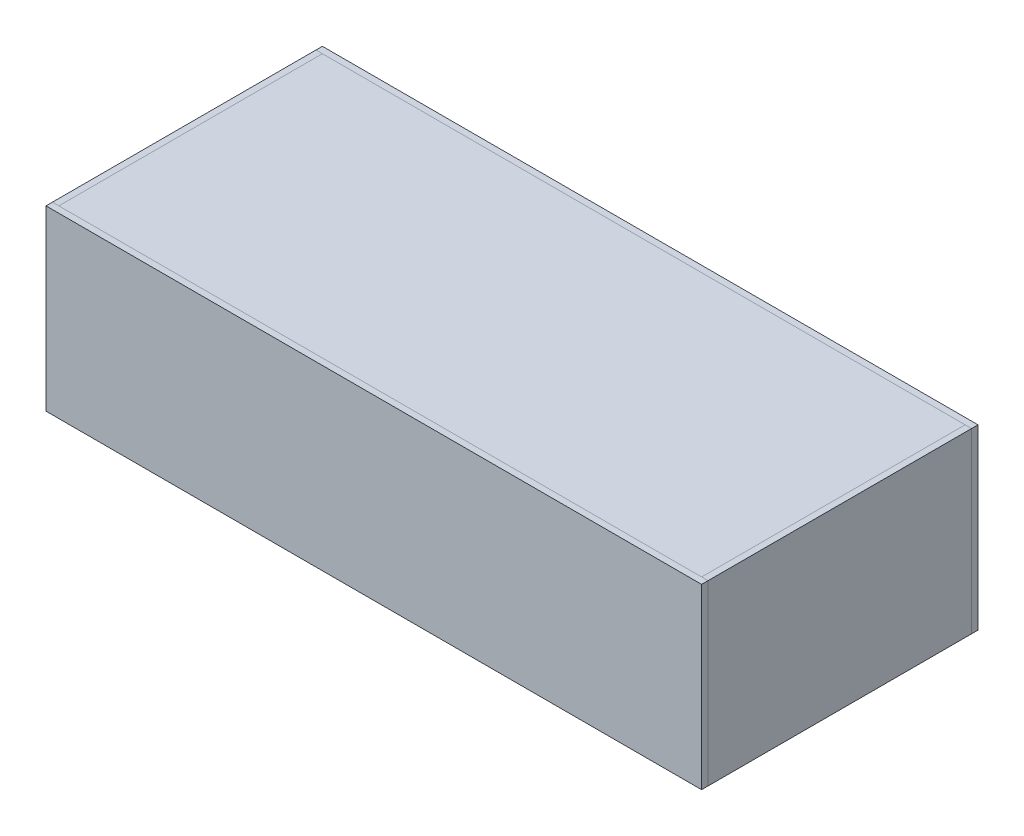
from build123d import *

# Parameters (mm, degrees)
ESQUISSE1_W             = 1530
ESQUISSE1_H             = 415
BOSS_EXTRU_1_DEPTH      = 15
ESQUISSE2_W             = 15
ESQUISSE2_H             = 415
EXTRU_MINCE1_DEPTH      = 615
EXTRU_MINCE1_2_DEPTH    = 615
ESQUISSE3_W             = 615
ESQUISSE3_H             = 15
EXTRU_MINCE2_DEPTH      = 1500
ESQUISSE5_W             = 15
ESQUISSE5_H             = 100
BOSS_EXTRU_2_DEPTH      = 1500
ESQUISSE8_W             = 450
ESQUISSE8_H             = 15
BOSS_EXTRU_3_DEPTH      = 1500
ESQUISSE9_W             = 515
ESQUISSE9_H             = 15
BOSS_EXTRU_4_DEPTH      = 1500
ESQUISSE10_W            = 15
ESQUISSE10_H            = 285
BOSS_EXTRU_5_DEPTH      = 1500
ESQUISSE12_W            = 15
ESQUISSE12_H            = 300
BOSS_EXTRU_6_DEPTH      = 100
ESQUISSE12_H_2          = 285
BOSS_EXTRU_6_2_DEPTH    = 100
ESQUISSE13_R            = 181.9
ENL_V_MAT_EXTRU_1_DEPTH = 15
ESQUISSE14_W            = 1530
ESQUISSE14_H            = 415
BOSS_EXTRU_7_DEPTH      = 15
ESQUISSE16_W            = 15
ESQUISSE16_H            = 85
BOSS_EXTRU_8_DEPTH      = 1500


with BuildPart() as part:
    # Esquisse1 → Boss.-Extru.1 (new body)
    with BuildSketch(Plane.XY):
        with Locations((50.424193548, -67.799193548)):
            Rectangle(ESQUISSE1_W, ESQUISSE1_H)
    extrude(amount=BOSS_EXTRU_1_DEPTH)


with BuildPart() as body_2:
    # Esquisse2 → Extru.-Mince1 (new body)
    with BuildSketch(Plane.XY.offset(15)):
        with Locations((-707.075806452, -67.799193548)):
            Rectangle(ESQUISSE2_W, ESQUISSE2_H)
    extrude(amount=EXTRU_MINCE1_DEPTH)


with BuildPart() as body_3:
    # Esquisse2 → Extru.-Mince1 2 (new body)
    with BuildSketch(Plane.XY.offset(15)):
        with Locations((807.924193548, -67.799193548)):
            Rectangle(ESQUISSE2_W, ESQUISSE2_H)
    extrude(amount=EXTRU_MINCE1_2_DEPTH)


with BuildPart() as body_4:
    # Esquisse3 → Extru.-Mince2 (new body)
    with BuildSketch(Plane(origin=(-699.575806452, 0, 0), x_dir=(0, 0, -1), z_dir=(1, 0, 0))):
        with Locations((-322.5, 132.200806452)):
            Rectangle(ESQUISSE3_W, ESQUISSE3_H)
    extrude(amount=EXTRU_MINCE2_DEPTH)


with BuildPart() as body_5:
    # Esquisse5 → Boss.-Extru.2 (new body)
    with BuildSketch(Plane(origin=(-699.575806452, 0, 0), x_dir=(0, 0, -1), z_dir=(1, 0, 0))):
        with Locations((-172.5, 74.700806452)):
            Rectangle(ESQUISSE5_W, ESQUISSE5_H)
    extrude(amount=BOSS_EXTRU_2_DEPTH)


with BuildPart() as body_6:
    # Esquisse8 → Boss.-Extru.3 (new body)
    with BuildSketch(Plane(origin=(-699.575806452, 0, 0), x_dir=(0, 0, -1), z_dir=(1, 0, 0))):
        with Locations((-405, 32.200806452)):
            Rectangle(ESQUISSE8_W, ESQUISSE8_H)
    extrude(amount=BOSS_EXTRU_3_DEPTH)


with BuildPart() as body_7:
    # Esquisse9 → Boss.-Extru.4 (new body)
    with BuildSketch(Plane(origin=(-699.575806452, 0, 0), x_dir=(0, 0, -1), z_dir=(1, 0, 0))):
        with Locations((-372.5, -267.799193548)):
            Rectangle(ESQUISSE9_W, ESQUISSE9_H)
    extrude(amount=BOSS_EXTRU_4_DEPTH)

    # Esquisse13 → Enlèv. mat.-Extru.1 (cut)
    with BuildSketch(Plane.XZ.offset(275.299193548)):
        with Locations(Location((50.424193548, 372.5, 0), (0, 0, 270))):
            Circle(ESQUISSE13_R)
        with Locations(Location((-424.525806452, 372.5, 0), (0, 0, 270))):
            Circle(ESQUISSE13_R)
        with Locations(Location((525.374193548, 372.5, 0), (0, 0, 270))):
            Circle(ESQUISSE13_R)
    extrude(amount=-ENL_V_MAT_EXTRU_1_DEPTH, mode=Mode.SUBTRACT)


with BuildPart() as body_8:
    # Esquisse10 → Boss.-Extru.5 (new body)
    with BuildSketch(Plane(origin=(-699.575806452, 0, 0), x_dir=(0, 0, -1), z_dir=(1, 0, 0))):
        with Locations((-122.5, -117.799193548)):
            Rectangle(ESQUISSE10_W, ESQUISSE10_H)
    extrude(amount=BOSS_EXTRU_5_DEPTH)


with BuildPart() as body_9:
    # Esquisse12 → Boss.-Extru.6 (new body)
    with BuildSketch(Plane(origin=(0, 0, 115), x_dir=(-1, 0, 0), z_dir=(0, 0, -1))):
        with Locations((199.575806452, -125.299193548)):
            Rectangle(ESQUISSE12_W, ESQUISSE12_H)
    extrude(amount=BOSS_EXTRU_6_DEPTH)


with BuildPart() as body_10:
    # Esquisse12 → Boss.-Extru.6 2 (new body)
    with BuildSketch(Plane(origin=(0, 0, 115), x_dir=(-1, 0, 0), z_dir=(0, 0, -1))):
        with Locations((-300.424193548, -117.799193548)):
            Rectangle(ESQUISSE12_W, ESQUISSE12_H_2)
    extrude(amount=BOSS_EXTRU_6_2_DEPTH)


with BuildPart() as body_11:
    # Esquisse14 → Boss.-Extru.7 (new body)
    with BuildSketch(Plane.XY.offset(630)):
        with Locations((50.424193548, -67.799193548)):
            Rectangle(ESQUISSE14_W, ESQUISSE14_H)
    extrude(amount=BOSS_EXTRU_7_DEPTH)


with BuildPart() as body_12:
    # Esquisse16 → Boss.-Extru.8 (new body)
    with BuildSketch(Plane(origin=(-699.575806452, 0, 0), x_dir=(0, 0, -1), z_dir=(1, 0, 0))):
        with Locations((-405, 82.200806452)):
            Rectangle(ESQUISSE16_W, ESQUISSE16_H)
    extrude(amount=BOSS_EXTRU_8_DEPTH)


solid = Compound([part.part, body_2.part, body_3.part, body_4.part, body_5.part, body_6.part, body_7.part, body_8.part, body_9.part, body_10.part, body_11.part, body_12.part])
